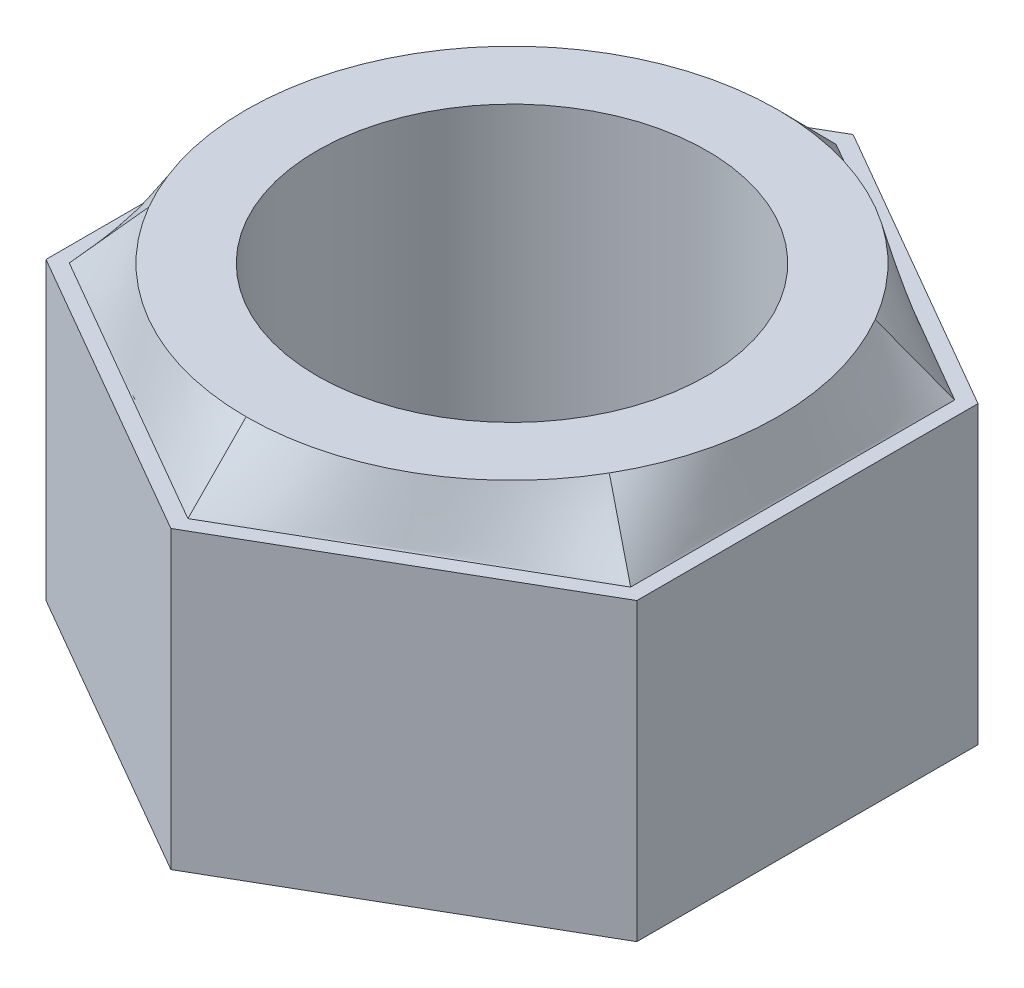
from build123d import *

# Parameters (mm, degrees)
BODY_DEPTH           = 5
M6_CLEARANCE_HOLE1_D = 6.6


with BuildPart() as part:
    # Sketch1 → Body (new body)
    with BuildSketch(Plane(origin=(0, 0, 0), x_dir=(1, 0, 0), z_dir=(0, 1, 0))):
        Polygon((0, 5.773502692), (-5, 2.886751346), (-5, -2.886751346), (0, -5.773502692), (5, -2.886751346), (5, 2.886751346), align=None)
    extrude(amount=BODY_DEPTH)

    # Sketch5 → Loft1 section 0
    with BuildSketch(Plane(origin=(0, 5, 0), x_dir=(1, 0, 0), z_dir=(0, 1, 0))):
        with BuildLine():
            Line((4.75, 2.742413779), (0, 5.484827557))
            Line((0, 5.484827557), (-4.75, 2.742413779))
            Line((-4.75, 2.742413779), (-4.75, -2.742413779))
            Line((-4.75, -2.742413779), (0, -5.484827557))
            Line((0, -5.484827557), (4.75, -2.742413779))
            Line((4.75, -2.742413779), (4.75, 2.742413779))
        make_face()
    # Sketch4 for Loft1 → Loft1 section 1
    with BuildSketch(Plane(origin=(0, 6, 0), x_dir=(1, 0, 0), z_dir=(0, 1, 0))):
        with BuildLine():
            # circular arc as an exact rational Bezier (weights 1, cos(half-angle), 1)
            Bezier((3.897114317, 2.25), (2.598076211, 4.5), (0, 4.5), weights=[1, 0.866025404, 1])
            Bezier((0, 4.5), (-2.598076211, 4.5), (-3.897114317, 2.25), weights=[1, 0.866025404, 1])
            Bezier((-3.897114317, 2.25), (-5.196152423, 0), (-3.897114317, -2.25), weights=[1, 0.866025404, 1])
            Bezier((-3.897114317, -2.25), (-2.598076211, -4.5), (0, -4.5), weights=[1, 0.866025404, 1])
            Bezier((0, -4.5), (2.598076211, -4.5), (3.897114317, -2.25), weights=[1, 0.866025404, 1])
            Bezier((3.897114317, -2.25), (5.196152423, 0), (3.897114317, 2.25), weights=[1, 0.866025404, 1])
        make_face()
    loft()

    # M6 Clearance Hole1 (through all)
    with Locations(Plane(origin=(0, 6, 0), x_dir=(1, 0, 0), z_dir=(0, 1, 0))):
        with Locations((0, 0)):
            Hole(M6_CLEARANCE_HOLE1_D / 2)


solid = part.part
